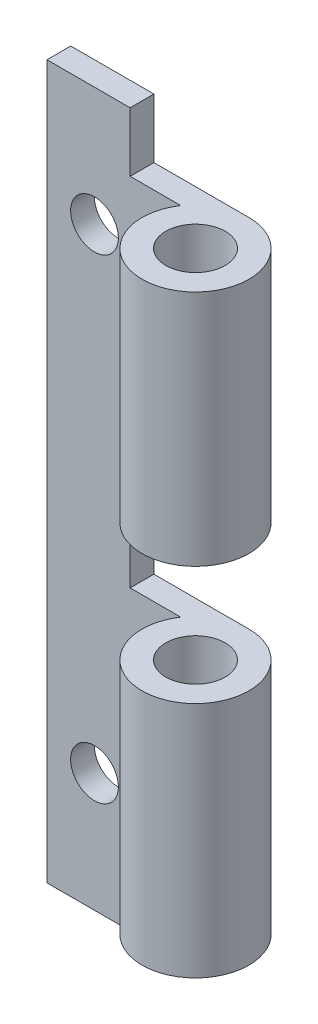
from build123d import *

# Parameters (mm, degrees)
SKETCH1_W              = 19.05
SKETCH1_H              = 76.2
BOSS_EXTRUDE1_DEPTH    = 2.54
SKETCH2_R              = 5.715
SKETCH2_R_2            = 3.175
BOSS_EXTRUDE2_DEPTH    = 76.2
SKETCH3_W              = 25.4
SKETCH3_H              = 6.35
SKETCH3_H_2            = 12.7
CUT_EXTRUDE1_DEPTH     = 80.372459959
F_10_CLEARANCE_HOLE1_D = 5.1054


with BuildPart() as part:
    # Sketch1 → Boss-Extrude1 (new body)
    with BuildSketch(Plane.XY):
        with Locations((-9.525, 38.1)):
            Rectangle(SKETCH1_W, SKETCH1_H)
    extrude(amount=BOSS_EXTRUDE1_DEPTH)

    # Sketch2 → Boss-Extrude2 (add)
    with BuildSketch(Plane(origin=(0, 0, 0), x_dir=(-1, 0, 0), z_dir=(0, -1, 0))):
        with Locations((0, -5.715)):
            Circle(SKETCH2_R)
        with Locations(Location((0, -5.715, 0), (0, 0, 90))):
            Circle(SKETCH2_R_2, mode=Mode.SUBTRACT)
    extrude(amount=-BOSS_EXTRUDE2_DEPTH)

    # Sketch3 → Cut-Extrude1 (cut, through all)
    with BuildSketch(Plane(origin=(0, 0, 0), x_dir=(-1, 0, 0), z_dir=(0, 0, -1))):
        with Locations((-2.54, 3.175)):
            Rectangle(SKETCH3_W, SKETCH3_H)
        with Locations((-2.54, 73.025)):
            Rectangle(SKETCH3_W, SKETCH3_H)
        with Locations((-2.54, 38.1)):
            Rectangle(SKETCH3_W, SKETCH3_H_2)
    extrude(amount=-CUT_EXTRUDE1_DEPTH, mode=Mode.SUBTRACT)

    # #10 Clearance Hole1 (through all)
    with Locations(Plane.XY.offset(2.54)):
        with Locations((-13.97, 63.5), (-13.97, 12.7)):
            Hole(F_10_CLEARANCE_HOLE1_D / 2)


solid = part.part
